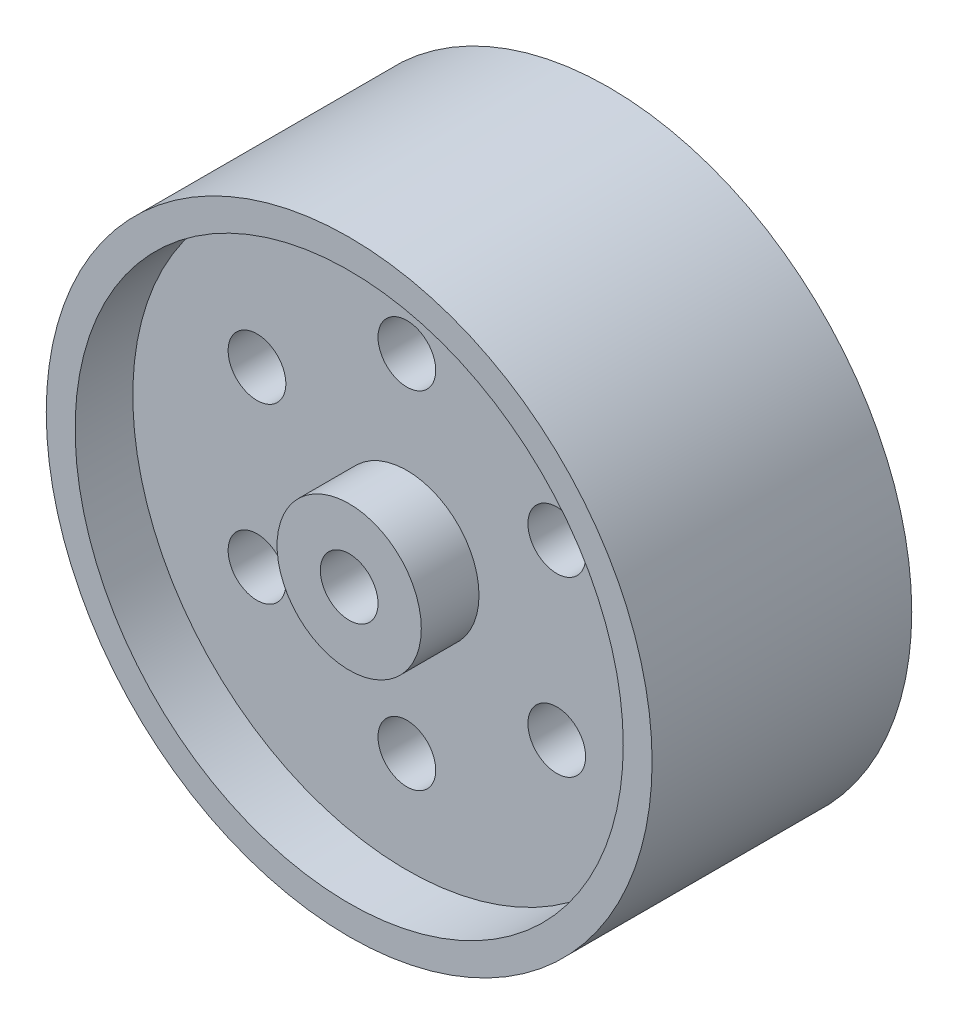
from build123d import *

# Parameters (mm, degrees)
SKETCH2_R          = 2
CUT_EXTRUDE3_DEPTH = 33.832910319


with BuildPart() as part:
    # Sketch1 → Revolve1 (revolve)
    with BuildSketch(Plane(origin=(0, 0, 0), x_dir=(0, 0, -1), z_dir=(1, 0, 0)), mode=Mode.PRIVATE) as revolve1_sk:
        Polygon((-7, 2), (-7, 5), (-3, 5), (-3, 19), (-7, 19), (-7, 21), (11, 21), (11, 15), (7, 15), (7, 2), align=None)
    revolve(revolve1_sk.sketch.rotate(Axis((0, 0, 6.263706564), (0, 0, -1)), 90), axis=Axis((0, 0, 6.263706564), (0, 0, -1)))

    # Sketch2 → Cut-Extrude3 (cut, through all)
    with BuildSketch(Plane(origin=(0, 0, -7), x_dir=(-1, 0, 0), z_dir=(0, 0, -1))):
        with Locations((0, 12)):
            Circle(SKETCH2_R)
        with Locations((10.392304845, 6)):
            Circle(SKETCH2_R)
        with Locations((10.392304845, -6)):
            Circle(SKETCH2_R)
        with Locations((0, -12)):
            Circle(SKETCH2_R)
        with Locations((-10.392304845, -6)):
            Circle(SKETCH2_R)
        with Locations((-10.392304845, 6)):
            Circle(SKETCH2_R)
    extrude(amount=-CUT_EXTRUDE3_DEPTH, mode=Mode.SUBTRACT)


solid = part.part
